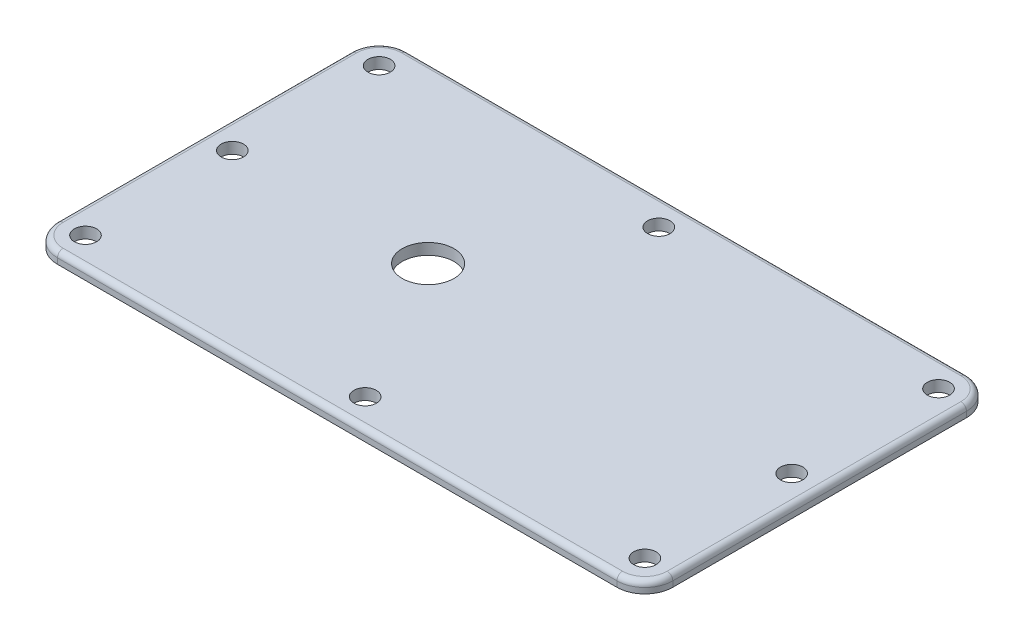
from build123d import *

# Parameters (mm, degrees)
BOSS_EXTRUDE1_DEPTH    = 4
FILLET1_R              = 2
F_8_0MM_DOWEL_HOLE1_D  = 8
M20X1_5_TAPPED_HOLE1_D = 18.5


with BuildPart() as part:
    # Sketch1 → Boss-Extrude1 (new body)
    with BuildSketch(Plane(origin=(0, 0, 0), x_dir=(1, 0, 0), z_dir=(0, 1, 0))):
        with BuildLine():
            Line((-90.571428571, 63.839285714), (109.428571429, 63.839285714))
            ThreePointArc((109.428571429, 63.839285714), (116.49963924, 60.910353526), (119.428571429, 53.839285714))
            Line((119.428571429, 53.839285714), (119.428571429, -51.160714286))
            ThreePointArc((119.428571429, -51.160714286), (116.49963924, -58.231782098), (109.428571429, -61.160714286))
            Line((109.428571429, -61.160714286), (-90.571428571, -61.160714286))
            ThreePointArc((-90.571428571, -61.160714286), (-97.642496383, -58.231782098), (-100.571428571, -51.160714286))
            Line((-100.571428571, -51.160714286), (-100.571428571, 53.839285714))
            ThreePointArc((-100.571428571, 53.839285714), (-97.642496383, 60.910353526), (-90.571428571, 63.839285714))
        make_face()
    extrude(amount=BOSS_EXTRUDE1_DEPTH)

    # Fillet1
    fillet1_edges = [part.edges().sort_by_distance(p)[0] for p in [
        (-97.642496383, 4, -60.910353526),
        (-100.571428571, 4, -1.339285714),
        (-97.642496383, 4, 58.231782098),
        (9.428571429, 4, 61.160714286),
        (116.49963924, 4, 58.231782098),
        (119.428571429, 4, -1.339285714),
        (116.49963924, 4, -60.910353526),
        (9.428571429, 4, -63.839285714),
    ]]
    fillet(fillet1_edges, radius=FILLET1_R)

    # Ø8.0mm Dowel Hole1 (through all)
    with Locations(Plane(origin=(0, 4, 0), x_dir=(1, 0, 0), z_dir=(0, 1, 0))):
        with Locations((-90.571428571, 53.839285714), (109.428571429, 53.839285714), (-90.571428571, -51.160714286), (109.428571429, -51.160714286), (109.428571429, 1.339285714), (9.428571429, 53.839285714), (-90.571428571, 1.339285714), (9.428571429, -51.160714286)):
            Hole(F_8_0MM_DOWEL_HOLE1_D / 2)

    # M20x1.5 Tapped Hole1 (through all)
    with Locations(Plane(origin=(0, 4, 0), x_dir=(1, 0, 0), z_dir=(0, 1, 0))):
        with Locations((-20.571428571, 1.339285714)):
            Hole(M20X1_5_TAPPED_HOLE1_D / 2)


solid = part.part
